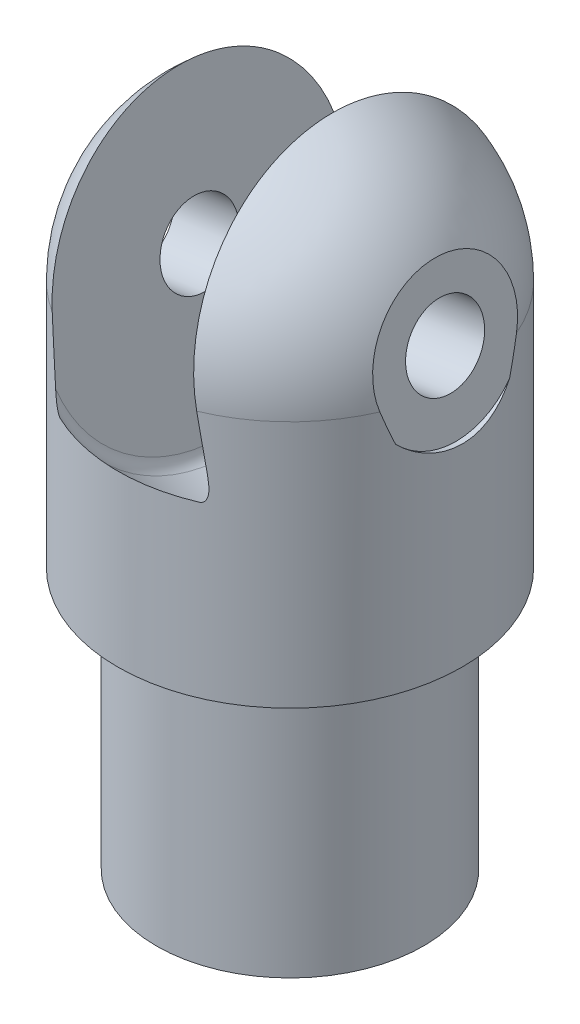
from build123d import *

# Parameters (mm, degrees)
SKETCH1_R                     = 12.9921
BOSS_EXTRUDE1_DEPTH           = 25.4
CUT_EXTRUDE1_DEPTH            = 103.48807232
CUT_EXTRUDE1_DEPTH_BACK       = 103.48807232
SKETCH3_R                     = 3.81
CUT_REVOLVE10_ANGLE           = 90
CUT_REVOLVE10_OTHER_WAY_ANGLE = 180
CUT_EXTRUDE4_DEPTH            = 32.004
FILLET1_R                     = 1.27
SKETCH15_R                    = 7.62
CUT_EXTRUDE5_DEPTH            = 10.16


with BuildPart() as part:
    # Sketch1 → Boss-Extrude1 (new body)
    with BuildSketch(Plane(origin=(0, 0, 0), x_dir=(1, 0, 0), z_dir=(0, 1, 0))):
        Circle(SKETCH1_R)
    extrude(amount=BOSS_EXTRUDE1_DEPTH)

    # Sketch2 → Revolve1 (revolve)
    with BuildSketch(Plane(origin=(0, 0, 0), x_dir=(0, 0, -1), z_dir=(1, 0, 0))):
        with BuildLine():
            Line((-16.764, 25.4), (-16.764, 49.53))
            ThreePointArc((-16.764, 49.53), (-11.85393808, 61.38393808), (0, 66.294))
            Line((0, 66.294), (0, 25.4))
            Line((0, 25.4), (-16.764, 25.4))
        make_face()
    revolve(axis=Axis((0, 25.4, 0), (0, 1, 0)))

    # Sketch3 → Cut-Extrude1 (cut, two sides: drawn at the far end of the back side and taken through both)
    with BuildSketch(Plane(origin=(-6.855604404, 98.310160002, 0), x_dir=(0, 0, -1), z_dir=(-0.9902680687415708, -0.1391731009600624, 0)).offset(-CUT_EXTRUDE1_DEPTH_BACK)):
        with Locations((0, 49.259550562)):
            Circle(SKETCH3_R)
    extrude(amount=CUT_EXTRUDE1_DEPTH + CUT_EXTRUDE1_DEPTH_BACK, mode=Mode.SUBTRACT)

    # Sketch11 → Cut-Revolve10 (revolve, cut)
    with BuildSketch(Plane.XY):
        with BuildLine():
            Line((-8.803483131, 48.292751132), (-11.047927713, 64.262804154))
            ThreePointArc((-11.047927713, 64.262804154), (-3.937784002, 67.51905451), (3.88252071, 67.531062689))
            Line((3.88252071, 67.531062689), (6.288202237, 50.413749191))
            Line((6.288202237, 50.413749191), (-8.803483131, 48.292751132))
        make_face()
    revolve(axis=Axis((17.272404581, 51.957478157, 0), (-0.9902680687415708, -0.1391731009600623, 0)), revolution_arc=CUT_REVOLVE10_ANGLE, mode=Mode.SUBTRACT)

    # Sketch11 → Cut-Revolve10 other way (revolve, cut)
    with BuildSketch(Plane.XY):
        with BuildLine():
            Line((-8.803483131, 48.292751132), (-11.047927713, 64.262804154))
            ThreePointArc((-11.047927713, 64.262804154), (-3.937784002, 67.51905451), (3.88252071, 67.531062689))
            Line((3.88252071, 67.531062689), (6.288202237, 50.413749191))
            Line((6.288202237, 50.413749191), (-8.803483131, 48.292751132))
        make_face()
    revolve(axis=Axis((17.272404581, 51.957478157, 0), (0.9902680687415708, 0.1391731009600623, 0)), revolution_arc=CUT_REVOLVE10_OTHER_WAY_ANGLE, mode=Mode.SUBTRACT)

    # Sketch13 → Cut-Revolve11 (revolve, cut)
    with BuildSketch(Plane.XY):
        with BuildLine():
            Line((-9.333732646, 52.065672474), (5.757952722, 54.186670533))
            Line((5.757952722, 54.186670533), (3.424787908, 70.78800081))
            ThreePointArc((3.424787908, 70.78800081), (-4.350762616, 71.36195799), (-11.66689746, 68.667002751))
            Line((-11.66689746, 68.667002751), (-9.333732646, 52.065672474))
        make_face()
    revolve(axis=Axis((-9.333732646, 52.065672474, 0), (0.9902680687415707, 0.1391731009600627, 0)), mode=Mode.SUBTRACT)

    # Sketch14 → Cut-Extrude4 (cut)
    with BuildSketch(Plane.XY):
        with BuildLine():
            Line((-8.803483131, 48.292751132), (-7.764410533, 40.899365431))
            ThreePointArc((-7.764410533, 40.899365431), (0.227058194, 38.789070404), (7.327274834, 43.020363489))
            Line((7.327274834, 43.020363489), (6.288202237, 50.413749191))
            Line((6.288202237, 50.413749191), (-8.803483131, 48.292751132))
        make_face()
    extrude(amount=-CUT_EXTRUDE4_DEPTH, mode=Mode.SUBTRACT)

    # Fillet1
    fillet1_edges = [part.edges().sort_by_distance(p)[0] for p in [
        (-6.92582295, 34.932504728, 8.835062719),
        (-7.200056805, 36.883780001, -6.782727573),
        (-7.764410533, 40.899365431, -13.631549898),
        (7.327274834, 43.020363489, -13.74173908),
        (7.891628562, 39.00477806, -6.782727573),
        (8.369397705, 35.60527397, 8.669914189),
    ]]
    fillet(fillet1_edges, radius=FILLET1_R)

    # Sketch15 → Cut-Extrude5 (cut)
    with BuildSketch(Plane(origin=(-8.265526251, -1.161643959, 0), x_dir=(0, 0, -1), z_dir=(-0.9902680687415708, -0.1391731009600624, 0))):
        with Locations((0, -49.047977445)):
            Circle(SKETCH15_R)
    cut_extrude5 = extrude(amount=CUT_EXTRUDE5_DEPTH, mode=Mode.SUBTRACT)

    # Mirror1: Cut-Extrude5 across plane
    add(cut_extrude5.mirror(Plane(origin=(6.826159117, 0.9593541, 0), x_dir=(0, 0, 1), z_dir=(-0.9902680687415707, -0.13917310096006238, 0))), mode=Mode.SUBTRACT)


solid = part.part
